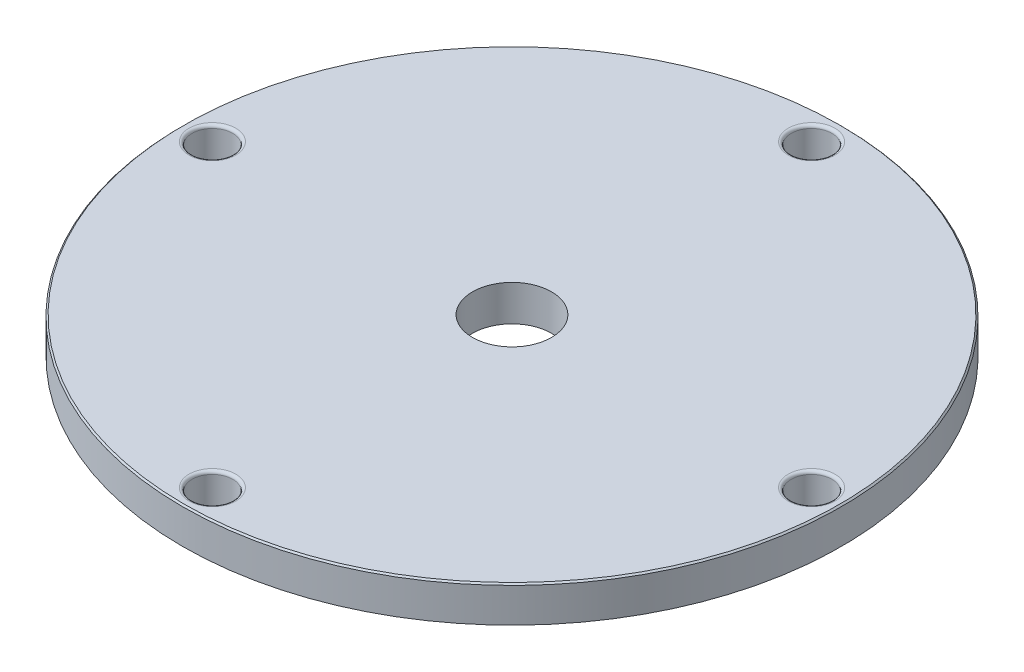
from build123d import *

# Parameters (mm, degrees)
SKETCH1_R           = 27.5
SKETCH1_R_2         = 3.3
BOSS_EXTRUDE1_DEPTH = 3
SKETCH2_R           = 1.7
CUT_EXTRUDE1_DEPTH  = 40.00640973
CHAMFER1_SIZE       = 0.125
FILLET1_R           = 0.25


with BuildPart() as part:
    # Sketch1 → Boss-Extrude1 (new body)
    with BuildSketch(Plane(origin=(0, 0, 0), x_dir=(1, 0, 0), z_dir=(0, 1, 0))):
        with Locations(Location((0, 0, 0), (0, 0, 270))):
            Circle(SKETCH1_R)
        with Locations(Location((0, 0, 0), (0, 0, 270))):
            Circle(SKETCH1_R_2, mode=Mode.SUBTRACT)
    extrude(amount=BOSS_EXTRUDE1_DEPTH)

    # Sketch2 → Cut-Extrude1 (cut, through all)
    with BuildSketch(Plane(origin=(0, 3, 0), x_dir=(1, 0, 0), z_dir=(0, 1, 0))):
        with Locations(Location((-25, 0, 0), (0, 0, 270))):
            Circle(SKETCH2_R)
        with Locations(Location((0, -25, 0), (0, 0, 270))):
            Circle(SKETCH2_R)
        with Locations(Location((25, 0, 0), (0, 0, 270))):
            Circle(SKETCH2_R)
        with Locations(Location((0, 25, 0), (0, 0, 270))):
            Circle(SKETCH2_R)
    extrude(amount=-CUT_EXTRUDE1_DEPTH, mode=Mode.SUBTRACT)

    # Chamfer1
    chamfer1_edges = [part.edges().sort_by_distance(p)[0] for p in [
        (0, 3, -27.5),
    ]]
    chamfer(chamfer1_edges, length=CHAMFER1_SIZE)

    # Fillet1
    fillet1_edges = [part.edges().sort_by_distance(p)[0] for p in [
        (-25, 3, -1.7),
        (0, 3, 23.3),
        (25, 3, -1.7),
        (0, 3, -26.7),
    ]]
    fillet(fillet1_edges, radius=FILLET1_R)


solid = part.part
